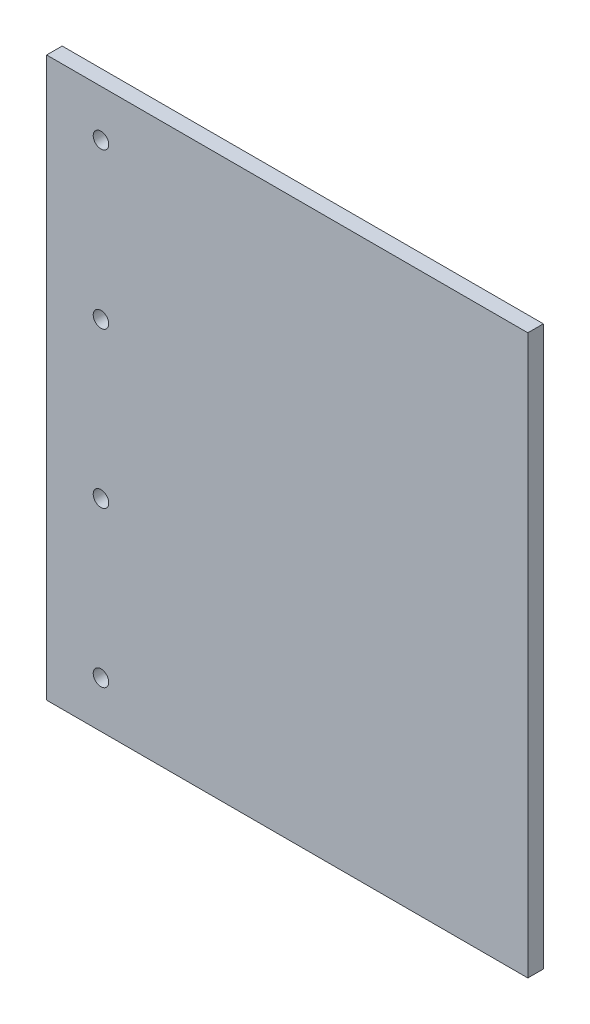
from build123d import *

# Parameters (mm, degrees)
SKETCH1_W                 = 393.7
SKETCH1_H                 = 457.2
PLATE_DEPTH               = 12.7
PATTERN_LINEAR_1004_COUNT = 4
PATTERN_LINEAR_1004_PITCH = 127


with BuildPart() as part:
    # Sketch1 → Plate (new body)
    with BuildSketch(Plane.XY):
        with Locations((196.85, 228.6)):
            Rectangle(SKETCH1_W, SKETCH1_H)
    extrude(amount=PLATE_DEPTH)

    # Sketch3 → Hole (revolve, cut)
    with BuildSketch(Plane(origin=(44.45, 38.1, 12.7), x_dir=(0, -1, 0), z_dir=(1, 0, 0))):
        Polygon((0, 0), (0, 29.215464931), (6.35, 25.4), (6.35, 0), align=None)
    hole = revolve(axis=Axis((44.45, 38.1, 19.05), (0, 0, -1)), mode=Mode.SUBTRACT)

    # Pattern Linear 1004: Hole ×4
    with Locations(*[(0, i * PATTERN_LINEAR_1004_PITCH, 0) for i in range(1, PATTERN_LINEAR_1004_COUNT)]):
        add(hole, mode=Mode.SUBTRACT)


solid = part.part
